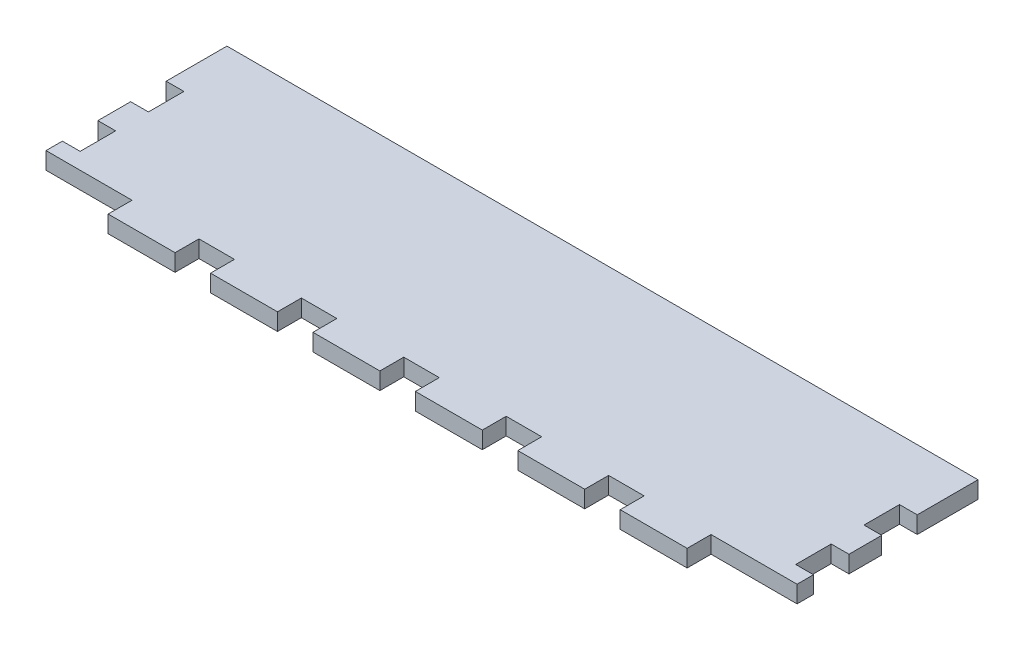
from build123d import *

# Parameters (mm, degrees)
SKETCH1_W           = 279.4
SKETCH1_H           = 57.15
BOSS_EXTRUDE1_DEPTH = 6.35
SKETCH3_W           = 24.892
SKETCH3_H           = 8.89
BOSS_EXTRUDE2_DEPTH = 6.35
SKETCH4_W           = 13.208
SKETCH4_H           = 13.208
CUT_EXTRUDE2_DEPTH  = 145.775822308
SKETCH5_W           = 311.517575851
SKETCH5_H           = 2.54
CUT_EXTRUDE3_DEPTH  = 145.775822308
SKETCH6_W           = 279.4
SKETCH6_H           = 12.7
BOSS_EXTRUDE3_DEPTH = 6.35


with BuildPart() as part:
    # Sketch1 → Boss-Extrude1 (new body)
    with BuildSketch(Plane(origin=(0, 0, 0), x_dir=(1, 0, 0), z_dir=(0, 1, 0))):
        Rectangle(SKETCH1_W, SKETCH1_H)
    extrude(amount=BOSS_EXTRUDE1_DEPTH)

    # Sketch3 → Boss-Extrude2 (add)
    with BuildSketch(Plane(origin=(0, 0, 0), x_dir=(1, 0, 0), z_dir=(0, 1, 0))):
        with Locations((-95.25, -33.02)):
            Rectangle(SKETCH3_W, SKETCH3_H)
        with Locations((-57.15, -33.02)):
            Rectangle(SKETCH3_W, SKETCH3_H)
        with Locations((-19.05, -33.02)):
            Rectangle(SKETCH3_W, SKETCH3_H)
        with Locations((19.05, -33.02)):
            Rectangle(SKETCH3_W, SKETCH3_H)
        with Locations((57.15, -33.02)):
            Rectangle(SKETCH3_W, SKETCH3_H)
        with Locations((95.25, -33.02)):
            Rectangle(SKETCH3_W, SKETCH3_H)
    extrude(amount=BOSS_EXTRUDE2_DEPTH)

    # Sketch4 → Cut-Extrude2 (cut, through all)
    with BuildSketch(Plane(origin=(0, 0, 0), x_dir=(1, 0, 0), z_dir=(0, 1, 0))):
        with Locations((-139.7, 9.525)):
            Rectangle(SKETCH4_W, SKETCH4_H)
        with Locations((-139.7, -15.875)):
            Rectangle(SKETCH4_W, SKETCH4_H)
        with Locations((139.7, -15.875)):
            Rectangle(SKETCH4_W, SKETCH4_H)
        with Locations((139.7, 9.525)):
            Rectangle(SKETCH4_W, SKETCH4_H)
    extrude(amount=CUT_EXTRUDE2_DEPTH, mode=Mode.SUBTRACT)

    # Sketch5 → Cut-Extrude3 (cut, through all)
    with BuildSketch(Plane(origin=(0, 6.35, 0), x_dir=(1, 0, 0), z_dir=(0, 1, 0))):
        with Locations((16.058787925, 27.305)):
            Rectangle(SKETCH5_W, SKETCH5_H)
    extrude(amount=-CUT_EXTRUDE3_DEPTH, mode=Mode.SUBTRACT)

    # Sketch6 → Boss-Extrude3 (add)
    with BuildSketch(Plane(origin=(0, 6.35, 0), x_dir=(1, 0, 0), z_dir=(0, 1, 0))):
        with Locations((0, 32.385)):
            Rectangle(SKETCH6_W, SKETCH6_H)
    extrude(amount=-BOSS_EXTRUDE3_DEPTH)


solid = part.part
